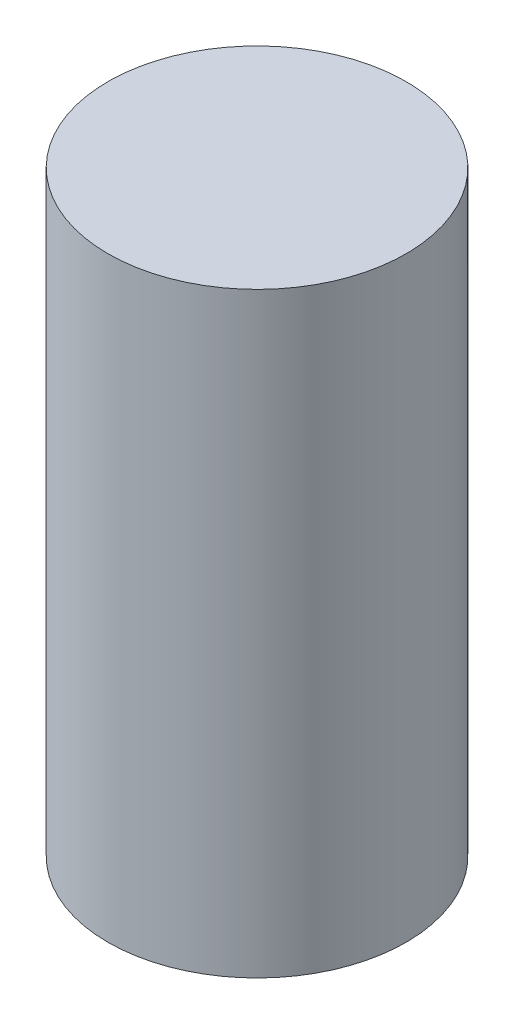
from build123d import *

# Parameters (mm, degrees)
SKETCH_1_R          = 7.5
EXTRUDE_1_DEPTH     = 30
SKETCH_2_R          = 2.25
CUT_EXTRUDE_1_DEPTH = 20


with BuildPart() as part:
    # 草图1 → 凸台-拉伸1 (new body)
    with BuildSketch(Plane(origin=(0, 0, 0), x_dir=(1, 0, 0), z_dir=(0, 1, 0))):
        with Locations(Location((0, 0, 0), (0, 0, 270))):
            Circle(SKETCH_1_R)
    extrude(amount=EXTRUDE_1_DEPTH)

    # 草图2 → 切除-拉伸1 (cut)
    with BuildSketch(Plane.XZ):
        with Locations(Location((0, 0, 0), (0, 0, 270))):
            Circle(SKETCH_2_R)
    extrude(amount=-CUT_EXTRUDE_1_DEPTH, mode=Mode.SUBTRACT)


solid = part.part
